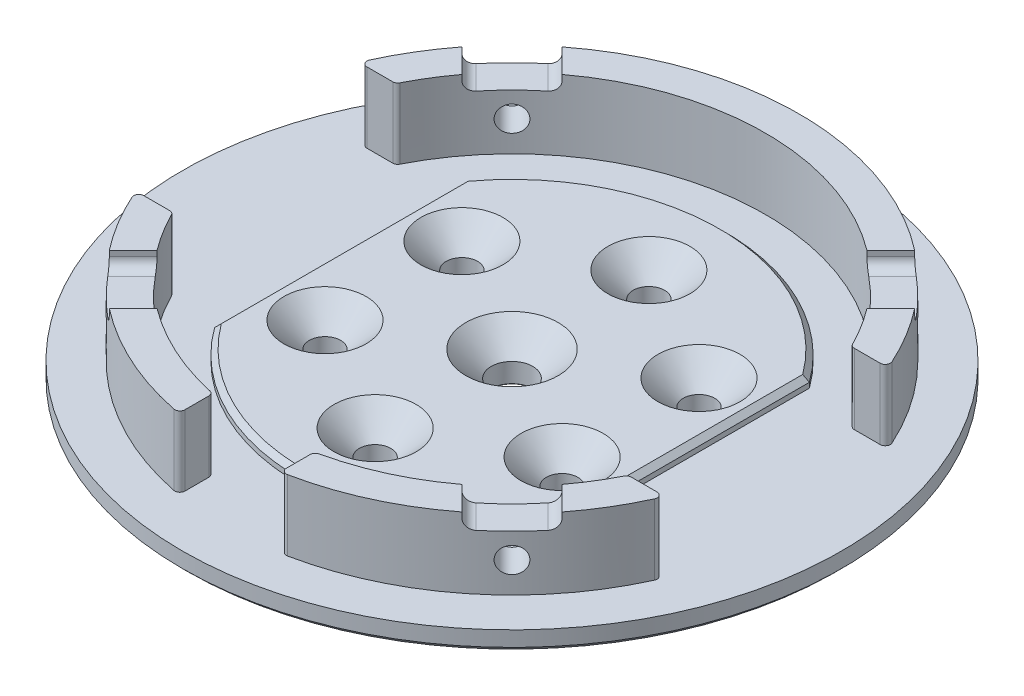
from build123d import *

# Parameters (mm, degrees)
SKETCH_1_R               = 32.5
EXTRUDE_1_DEPTH          = 2
EXTRUDE_2_DEPTH          = 6.45
SKETCH_4_R               = 1.25
CUT_EXTRUDE_1_DEPTH      = 4
PATTERN_CIRCULAR_1_COUNT = 4
EXTRUDE_3_DEPTH          = 0.5
FILLET_1_R               = 0.5
CHAMFER_2_SIZE           = 0.5
SKETCH_7_R               = 26
EXTRUDE_4_DEPTH          = 1.5
CUT_EXTRUDE_2_DEPTH      = 9
CUT_EXTRUDE_2_DEPTH_BACK = 48.134939292
SKETCH_8_R               = 2.05
SKETCH_8_R_2             = 1.55
SKETCH_9_R               = 21
SKETCH_9_R_2             = 2.05
SKETCH_9_R_3             = 1.55
EXTRUDE_5_DEPTH          = 1
CHAMFER_4_SIZE           = 2.5
CUT_EXTRUDE_START        = -1
CUT_EXTRUDE_4_DEPTH      = 1
CHAMFER_5_SIZE           = 0.5
SKETCH_14_W              = 1.5
SKETCH_14_H              = 7
CUT_EXTRUDE_5_DEPTH      = 6
PATTERN_CIRCULAR_2_COUNT = 4
FILLET_2_R               = 1
CHAMFER_6_SIZE           = 0.1


with BuildPart() as part:
    # 草图1 → 凸台-拉伸1 (new body)
    with BuildSketch(Plane(origin=(0, 0, 0), x_dir=(1, 0, 0), z_dir=(0, 1, 0))):
        Circle(SKETCH_1_R)
    extrude(amount=EXTRUDE_1_DEPTH)

    # 草图2 → 凸台-拉伸2 (add)
    with BuildSketch(Plane(origin=(0, 2, 0), x_dir=(1, 0, 0), z_dir=(0, 1, 0))):
        with BuildLine():
            Line((-22.449944321, 11), (-26.074700382, 11))
            ThreePointArc((-26.074700382, 11), (0, 28.3), (26.074700382, 11))
            Line((26.074700382, 11), (22.449944321, 11))
            ThreePointArc((22.449944321, 11), (0, 25), (-22.449944321, 11))
        make_face()
        with BuildLine():
            Line((-22.449944321, -11), (-26.074700382, -11))
            ThreePointArc((-26.074700382, -11), (-17.675699121, -22.101123514), (-5, -27.854802099))
            Line((-5, -27.854802099), (-5, -24.494897428))
            ThreePointArc((-5, -24.494897428), (-15.293885214, -19.776174429), (-22.449944321, -11))
        make_face()
        with BuildLine():
            Line((22.449944321, -11), (26.074700382, -11))
            ThreePointArc((26.074700382, -11), (17.675699121, -22.101123514), (5, -27.854802099))
            Line((5, -27.854802099), (5, -24.494897428))
            ThreePointArc((5, -24.494897428), (15.293885214, -19.776174429), (22.449944321, -11))
        make_face()
    extrude(amount=EXTRUDE_2_DEPTH)

    # 草图4 → 切除-拉伸1 (cut)
    with BuildSketch(Plane(origin=(20.011121908, 0, -20.011121908), x_dir=(0, -1, 0), z_dir=(-0.7071067811865488, 0, 0.7071067811865464))):
        with Locations((-5, 0)):
            Circle(SKETCH_4_R)
    cut_extrude_1 = extrude(amount=CUT_EXTRUDE_1_DEPTH, mode=Mode.SUBTRACT)

    # 阵列(圆周)1: 切除-拉伸1 ×4 about axis
    pattern_circular_1_axis = Axis((0, 8.45, 0), (0, -1, 0))
    for i in range(1, PATTERN_CIRCULAR_1_COUNT):
        add(cut_extrude_1.rotate(pattern_circular_1_axis, i * 360 / PATTERN_CIRCULAR_1_COUNT), mode=Mode.SUBTRACT)

    # 草图5 → 凸台-拉伸3 (add)
    with BuildSketch(Plane(origin=(0, 8.45, 0), x_dir=(1, 0, 0), z_dir=(0, 1, 0))):
        with BuildLine():
            Line((5, -24.494897428), (5, -27.854802099))
            ThreePointArc((5, -27.854802099), (17.675699121, -22.101123514), (26.074700382, -11))
            Line((26.074700382, -11), (22.449944321, -11))
            ThreePointArc((22.449944321, -11), (15.293885214, -19.776174429), (5, -24.494897428))
        make_face()
        with BuildLine():
            Line((-22.449944321, -11), (-26.074700382, -11))
            ThreePointArc((-26.074700382, -11), (-17.675699121, -22.101123514), (-5, -27.854802099))
            Line((-5, -27.854802099), (-5, -24.494897428))
            ThreePointArc((-5, -24.494897428), (-15.293885214, -19.776174429), (-22.449944321, -11))
        make_face()
        with BuildLine():
            Line((22.449944321, 11), (26.074700382, 11))
            ThreePointArc((26.074700382, 11), (0, 28.3), (-26.074700382, 11))
            Line((-26.074700382, 11), (-22.449944321, 11))
            ThreePointArc((-22.449944321, 11), (0, 25), (22.449944321, 11))
        make_face()
    extrude(amount=EXTRUDE_3_DEPTH)

    # 圆角1
    fillet_1_edges = [part.edges().sort_by_distance(p)[0] for p in [
        (-5, 5.475, 27.854802099),
        (-5, 5.475, 24.494897428),
        (26.074700382, 5.225, -11),
        (22.449944321, 5.225, -11),
        (5, 5.225, 27.854802099),
        (22.449944321, 5.225, 11),
        (5, 5.225, 24.494897428),
        (26.074700382, 5.225, 11),
        (-22.449944321, 5.475, 11),
        (-26.074700382, 5.475, 11),
        (-22.449944321, 5.225, -11),
        (-26.074700382, 5.225, -11),
    ]]
    fillet(fillet_1_edges, radius=FILLET_1_R)

    # 倒角2
    chamfer_2_edges = [part.edges().sort_by_distance(p)[0] for p in [
        (-32.5, 0, 0),
    ]]
    chamfer(chamfer_2_edges, length=CHAMFER_2_SIZE)

    # 草图7 → 凸台-拉伸4 (add)
    with BuildSketch(Plane.XZ):
        Circle(SKETCH_7_R)
    extrude(amount=EXTRUDE_4_DEPTH)

    # 草图8 → 切除-拉伸2 (cut, two sides: drawn at the far end of the back side and taken through both)
    with BuildSketch(Plane.XZ.offset(1.5).offset(-CUT_EXTRUDE_2_DEPTH_BACK)):
        Circle(SKETCH_8_R)
        with Locations((0, 13.5)):
            Circle(SKETCH_8_R_2)
        with Locations((11.691342951, 6.75)):
            Circle(SKETCH_8_R_2)
        with Locations((11.691342951, -6.75)):
            Circle(SKETCH_8_R_2)
        with Locations((0, -13.5)):
            Circle(SKETCH_8_R_2)
        with Locations((-11.691342951, -6.75)):
            Circle(SKETCH_8_R_2)
        with Locations((-11.691342951, 6.75)):
            Circle(SKETCH_8_R_2)
    extrude(amount=CUT_EXTRUDE_2_DEPTH + CUT_EXTRUDE_2_DEPTH_BACK, mode=Mode.SUBTRACT)

    # 草图9 → 凸台-拉伸5 (add)
    with BuildSketch(Plane(origin=(0, 2, 0), x_dir=(1, 0, 0), z_dir=(0, 1, 0))):
        Circle(SKETCH_9_R)
        Circle(SKETCH_9_R_2, mode=Mode.SUBTRACT)
        with Locations((-11.691342951, 6.75)):
            Circle(SKETCH_9_R_3, mode=Mode.SUBTRACT)
        with Locations((0, 13.5)):
            Circle(SKETCH_9_R_3, mode=Mode.SUBTRACT)
        with Locations((11.691342951, 6.75)):
            Circle(SKETCH_9_R_3, mode=Mode.SUBTRACT)
        with Locations((11.691342951, -6.75)):
            Circle(SKETCH_9_R_3, mode=Mode.SUBTRACT)
        with Locations((0, -13.5)):
            Circle(SKETCH_9_R_3, mode=Mode.SUBTRACT)
        with Locations((-11.691342951, -6.75)):
            Circle(SKETCH_9_R_3, mode=Mode.SUBTRACT)
    extrude(amount=EXTRUDE_5_DEPTH)

    # 倒角4
    chamfer_4_edges = [part.edges().sort_by_distance(p)[0] for p in [
        (-2.05, 3, 0),
        (-1.55, 3, 13.5),
        (10.141342951, 3, 6.75),
        (10.141342951, 3, -6.75),
        (-1.55, 3, -13.5),
        (-13.241342951, 3, -6.75),
        (-13.241342951, 3, 6.75),
    ]]
    chamfer(chamfer_4_edges, length=CHAMFER_4_SIZE)

    # 草图12 → 切除-拉伸4 (cut)
    with BuildSketch(Plane(origin=(0, 3, 0), x_dir=(1, 0, 0), z_dir=(0, 1, 0)).offset(CUT_EXTRUDE_START)):
        with BuildLine():
            Line((-17, -12.328828006), (-17, 12.328828006))
            ThreePointArc((-17, 12.328828006), (-21, 0), (-17, -12.328828006))
        make_face()
        with BuildLine():
            ThreePointArc((17, -12.328828006), (21, 0), (17, 12.328828006))
            Line((17, 12.328828006), (17, -12.328828006))
        make_face()
    extrude(amount=CUT_EXTRUDE_4_DEPTH, mode=Mode.SUBTRACT)

    # 倒角5
    chamfer_5_edges = [part.edges().sort_by_distance(p)[0] for p in [
        (-26, -1.5, 0),
        (17, 3, 0),
        (0, 3, 21),
        (-17, 3, 0),
        (0, 3, -21),
    ]]
    chamfer(chamfer_5_edges, length=CHAMFER_5_SIZE)

    # 草图14 → 切除-拉伸5 (cut)
    with BuildSketch(Plane(origin=(20.011121908, 0, -20.011121908), x_dir=(0, -1, 0), z_dir=(-0.7071067811865488, 0, 0.7071067811865464))):
        with Locations((-8.2, 0)):
            Rectangle(SKETCH_14_W, SKETCH_14_H)
    cut_extrude_5 = extrude(amount=CUT_EXTRUDE_5_DEPTH, mode=Mode.SUBTRACT)

    # 阵列(圆周)2: 切除-拉伸5 ×4 about axis
    pattern_circular_2_axis = Axis((0, 8.45, 0), (0, -1, 0))
    for i in range(1, PATTERN_CIRCULAR_2_COUNT):
        add(cut_extrude_5.rotate(pattern_circular_2_axis, i * 360 / PATTERN_CIRCULAR_2_COUNT), mode=Mode.SUBTRACT)

    # 圆角2
    fillet_2_edges = [part.edges().sort_by_distance(p)[0] for p in [
        (16.205657942, 7.45, 21.155405411),
        (21.155405411, 7.45, 16.205657942),
        (16.205657942, 7.45, -21.155405411),
        (21.155405411, 7.45, -16.205657942),
        (-16.205657942, 7.45, -21.155405411),
        (-21.155405411, 7.45, -16.205657942),
        (-21.155405411, 7.45, 16.205657942),
        (-16.205657942, 7.45, 21.155405411),
    ]]
    fillet(fillet_2_edges, radius=FILLET_2_R)

    # 倒角6
    chamfer_6_edges = [part.edges().sort_by_distance(p)[0] for p in [
        (-1.55, -1.5, -13.5),
        (-13.241342951, -1.5, -6.75),
        (-13.241342951, -1.5, 6.75),
        (-2.05, -1.5, 0),
        (-1.55, -1.5, 13.5),
        (10.141342951, -1.5, -6.75),
        (10.141342951, -1.5, 6.75),
    ]]
    chamfer(chamfer_6_edges, length=CHAMFER_6_SIZE)


solid = part.part
